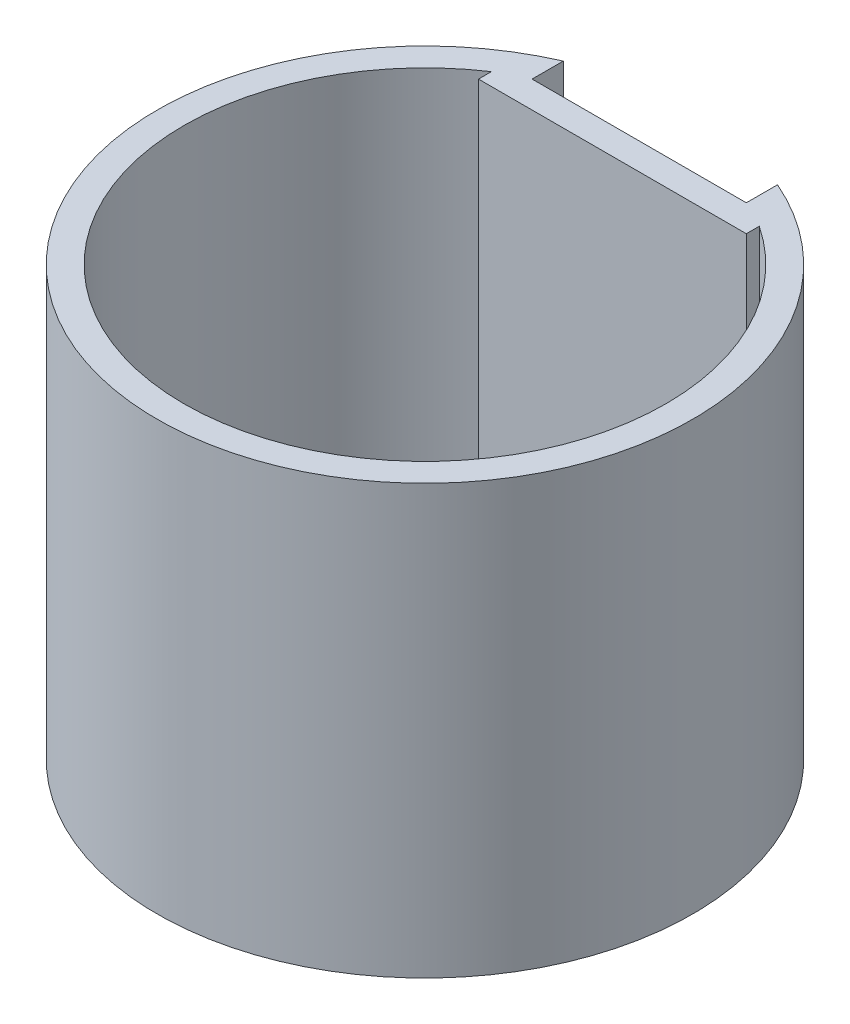
from build123d import *

# Parameters (mm, degrees)
BOSS_EXTRUDE2_DEPTH = 160
CUT_EXTRUDE1_DEPTH  = 150
SKETCH3_R           = 7.5
CUT_EXTRUDE2_DEPTH  = 10


with BuildPart() as part:
    # Sketch1 → Boss-Extrude2 (new body)
    with BuildSketch(Plane(origin=(0, 0, 0), x_dir=(1, 0, 0), z_dir=(0, 1, 0))):
        with BuildLine():
            Line((-40, 80), (40, 80))
            Line((40, 80), (40, 91.651513899))
            ThreePointArc((40, 91.651513899), (0, -100), (-40, 91.651513899))
            Line((-40, 91.651513899), (-40, 80))
        make_face()
    extrude(amount=-BOSS_EXTRUDE2_DEPTH)

    # Sketch2 → Cut-Extrude1 (cut)
    with BuildSketch(Plane(origin=(0, 0, 0), x_dir=(1, 0, 0), z_dir=(0, 1, 0))):
        with BuildLine():
            Line((-50, 74.833147735), (-50, 70))
            Line((-50, 70), (50, 70))
            Line((50, 70), (50, 74.833147735))
            ThreePointArc((50, 74.833147735), (0, -90), (-50, 74.833147735))
        make_face()
    extrude(amount=-CUT_EXTRUDE1_DEPTH, mode=Mode.SUBTRACT)

    # Sketch3 → Cut-Extrude2 (cut)
    with BuildSketch(Plane(origin=(0, 0, -80), x_dir=(-1, 0, 0), z_dir=(0, 0, -1))):
        with Locations(Location((0, -120, 0), (0, 0, 180))):
            Circle(SKETCH3_R)
    extrude(amount=-CUT_EXTRUDE2_DEPTH, mode=Mode.SUBTRACT)


solid = part.part
